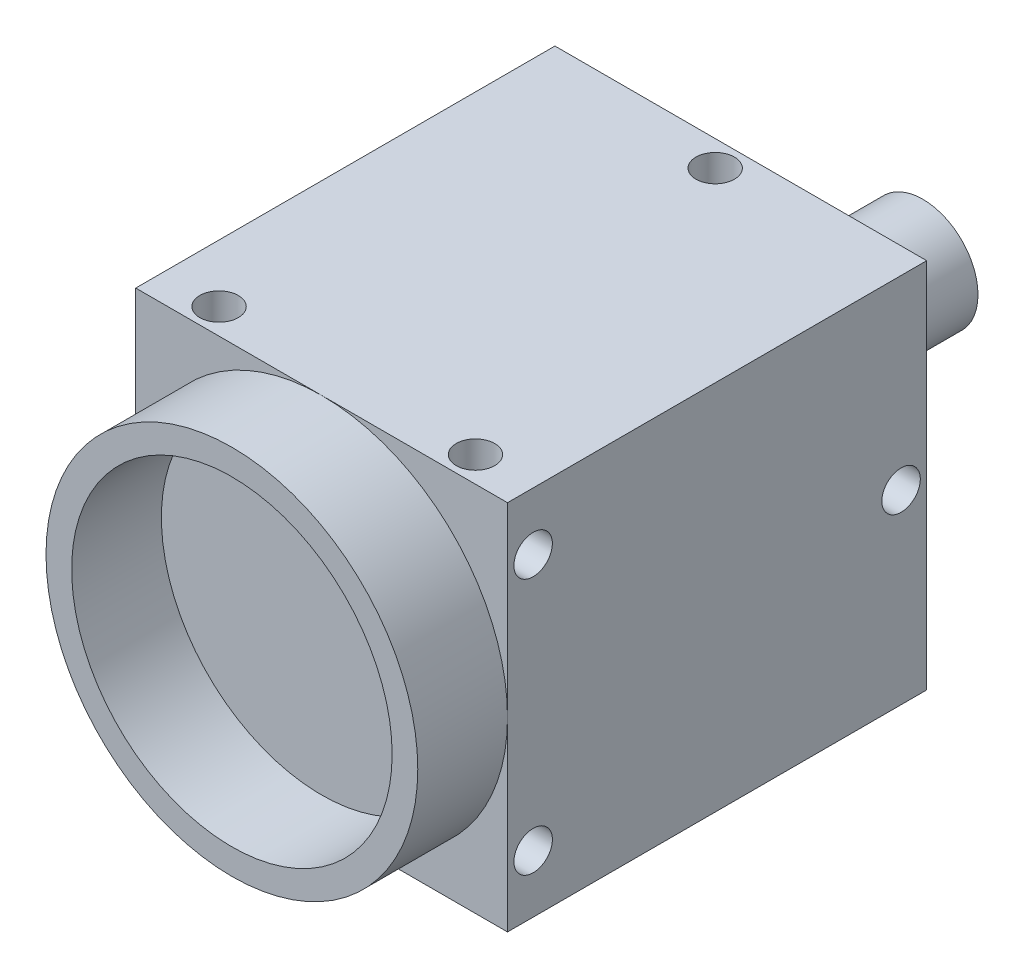
from build123d import *

# Parameters (mm, degrees)
SKETCH_1_W               = 29
SKETCH_1_H               = 32.7
EXTRUDE_1_DEPTH          = 29
SKETCH_2_R               = 14.5
SKETCH_2_R_2             = 12.5
EXTRUDE_2_DEPTH          = 7
SKETCH_3_R               = 1.5
CUT_EXTRUDE_1_DEPTH      = 5
CUT_EXTRUDE_START        = -2.9
SKETCH_4_R               = 1.5
CUT_EXTRUDE_2_DEPTH      = 2.9
SKETCH_5_R               = 4.3
SKETCH_5_R_2             = 3.5
EXTRUDE_3_DEPTH          = 6.9
SKETCH_6_W               = 16.3
SKETCH_6_H               = 15.8
EXTRUDE_4_DEPTH          = 2
PATTERN_CIRCULAR_1_COUNT = 4


with BuildPart() as part:
    # 草图1 → 凸台-拉伸1 (new body)
    with BuildSketch(Plane(origin=(0, 0, 0), x_dir=(1, 0, 0), z_dir=(0, 1, 0))):
        Rectangle(SKETCH_1_W, SKETCH_1_H)
    extrude(amount=EXTRUDE_1_DEPTH)

    # 草图2 → 凸台-拉伸2 (add)
    with BuildSketch(Plane.XY.offset(16.35)):
        with Locations((0, 14.5)):
            Circle(SKETCH_2_R)
        with Locations((0, 14.5)):
            Circle(SKETCH_2_R_2, mode=Mode.SUBTRACT)
    extrude(amount=EXTRUDE_2_DEPTH)

    # 草图3 → 切除-拉伸1 (cut)
    with BuildSketch(Plane.XZ):
        with Locations(Location((-10, 14.35, 0), (0, 0, 270))):
            Circle(SKETCH_3_R)
        with Locations(Location((10, 14.35, 0), (0, 0, 270))):
            Circle(SKETCH_3_R)
        with Locations(Location((-10, -14.35, 0), (0, 0, 270))):
            Circle(SKETCH_3_R)
        with Locations(Location((10, -14.35, 0), (0, 0, 270))):
            Circle(SKETCH_3_R)
    extrude(amount=-CUT_EXTRUDE_1_DEPTH, mode=Mode.SUBTRACT)

    # 草图4 → 切除-拉伸2 (cut)
    with BuildSketch(Plane(origin=(0, 29, 0), x_dir=(1, 0, 0), z_dir=(0, 1, 0)).offset(CUT_EXTRUDE_START)):
        with Locations(Location((0, 14.35, 0), (0, 0, 270))):
            Circle(SKETCH_4_R)
        with Locations(Location((-10, -14.35, 0), (0, 0, 90))):
            Circle(SKETCH_4_R)
        with Locations(Location((10, -14.35, 0), (0, 0, 90))):
            Circle(SKETCH_4_R)
    cut_extrude_2 = extrude(amount=CUT_EXTRUDE_2_DEPTH, mode=Mode.SUBTRACT)

    # 草图5 → 凸台-拉伸3 (add)
    with BuildSketch(Plane(origin=(0, 0, -16.35), x_dir=(-1, 0, 0), z_dir=(0, 0, -1))):
        with Locations(Location((-7.3, 21.8, 0), (0, 0, 180))):
            Circle(SKETCH_5_R)
        with Locations(Location((-7.3, 21.8, 0), (0, 0, 180))):
            Circle(SKETCH_5_R_2, mode=Mode.SUBTRACT)
    extrude(amount=EXTRUDE_3_DEPTH)

    # 草图6 → 凸台-拉伸4 (add)
    with BuildSketch(Plane(origin=(0, 0, -16.35), x_dir=(-1, 0, 0), z_dir=(0, 0, -1))):
        with Locations((0, 7.9)):
            Rectangle(SKETCH_6_W, SKETCH_6_H)
    extrude(amount=EXTRUDE_4_DEPTH)

    # 阵列(圆周)1: 切除-拉伸2 ×4 about axis, 1 skipped
    pattern_circular_1_axis = Axis((0, 14.5, 0), (0, 0, -1))
    add([cut_extrude_2.rotate(pattern_circular_1_axis, i * 360 / PATTERN_CIRCULAR_1_COUNT) for i in range(1, PATTERN_CIRCULAR_1_COUNT) if i not in (2,)], mode=Mode.SUBTRACT)


solid = part.part
